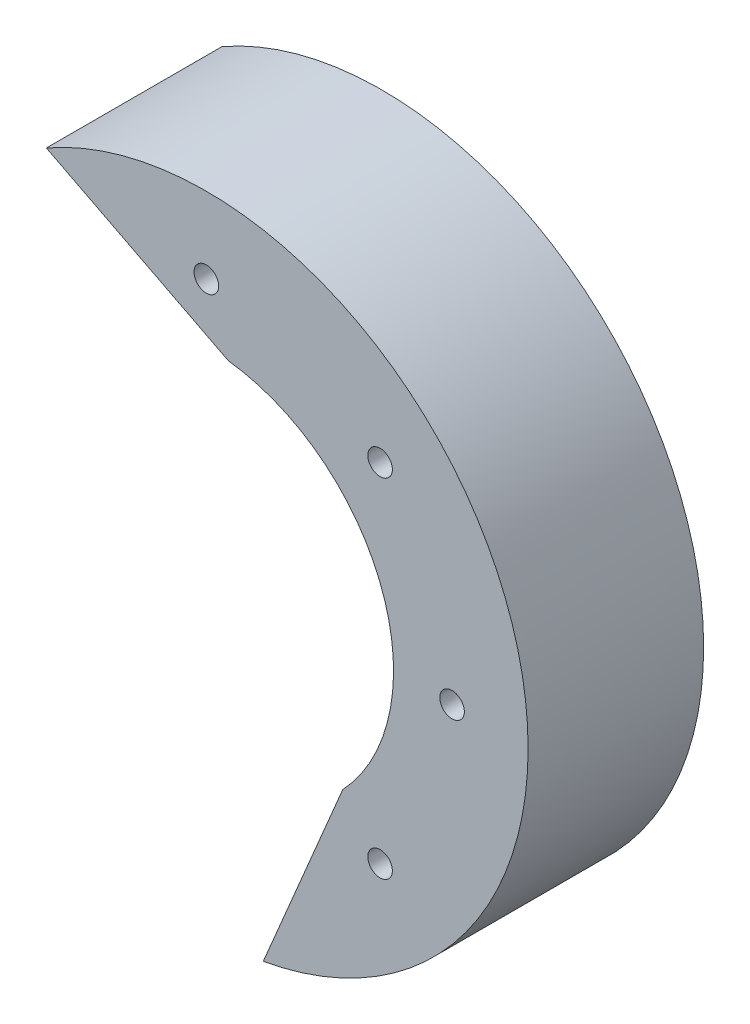
from build123d import *

# Parameters (mm, degrees)
EXTRUDE_1_DEPTH         = 30
HOLE_WIZARD_4_2_4_2_1_D = 4.2
SKETCH_7_R              = 5
CUT_EXTRUDE_1_DEPTH     = 20


with BuildPart() as part:
    # 草图1 → 凸台-拉伸1 (new body)
    with BuildSketch(Plane.XY):
        with BuildLine():
            Line((-27.342107977, 47.722207948), (3.772223289, 31.776883602))
            ThreePointArc((3.772223289, 31.776883602), (30.070163865, 10.944644586), (23.315477742, -21.917766712))
            Line((23.315477742, -21.917766712), (9.729974097, -54.132500442))
            ThreePointArc((9.729974097, -54.132500442), (51.683094143, 18.811107883), (-27.342107977, 47.722207948))
        make_face()
    extrude(amount=EXTRUDE_1_DEPTH)

    # Ø4.2 (4.2) 直径孔1 (through all)
    with Locations(Plane(origin=(0, 42, 30), x_dir=(1, 0, 0), z_dir=(0, 0, 1))):
        with Locations((0, 0), (29.69848481, -12.30151519), (42, -42), (29.69848481, -71.69848481)):
            Hole(HOLE_WIZARD_4_2_4_2_1_D / 2)

    # 草图7 → 切除-拉伸1 (cut)
    with BuildSketch(Plane(origin=(0, 0, 0), x_dir=(-1, 0, 0), z_dir=(0, 0, -1))):
        with Locations((0, 42)):
            Circle(SKETCH_7_R)
        with Locations((-29.69848481, 29.69848481)):
            Circle(SKETCH_7_R)
        with Locations((-42, 0)):
            Circle(SKETCH_7_R)
        with Locations((-29.69848481, -29.69848481)):
            Circle(SKETCH_7_R)
    extrude(amount=-CUT_EXTRUDE_1_DEPTH, mode=Mode.SUBTRACT)


solid = part.part
